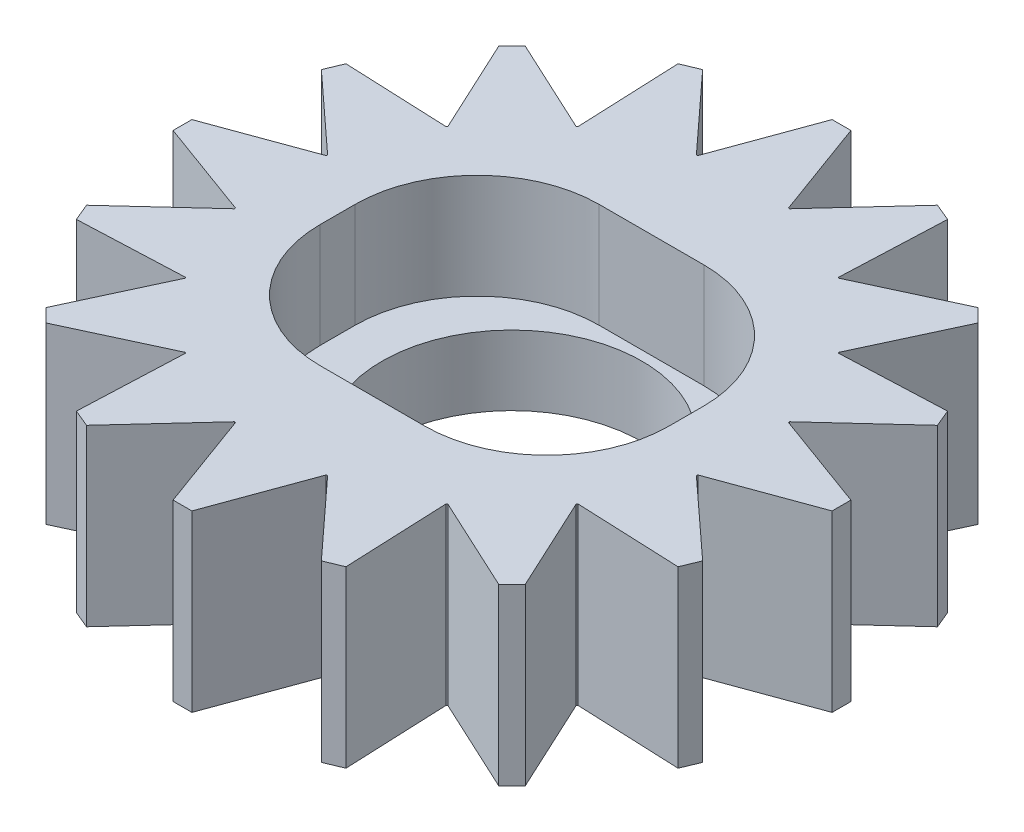
from build123d import *

# Parameters (mm, degrees)
SKETCH2_R           = 6.75
BOSS_EXTRUDE1_DEPTH = 5
SKETCH3_W           = 10
SKETCH3_H           = 8
CUT_EXTRUDE1_DEPTH  = 3
FILLET1_R           = 3.5
SKETCH4_R           = 3.725
CUT_EXTRUDE2_DEPTH  = 11.006248048
BOSS_EXTRUDE2_DEPTH = 5
CIRPATTERN1_COUNT   = 16


with BuildPart() as part:
    # Sketch2 → Boss-Extrude1 (new body)
    with BuildSketch(Plane(origin=(0, 0, 0), x_dir=(1, 0, 0), z_dir=(0, 1, 0))):
        with Locations(Location((0, 0, 0), (0, 0, 270))):
            Circle(SKETCH2_R)
    extrude(amount=BOSS_EXTRUDE1_DEPTH)

    # Sketch3 → Cut-Extrude1 (cut)
    with BuildSketch(Plane(origin=(0, 5, 0), x_dir=(1, 0, 0), z_dir=(0, 1, 0))):
        Rectangle(SKETCH3_W, SKETCH3_H)
    extrude(amount=-CUT_EXTRUDE1_DEPTH, mode=Mode.SUBTRACT)

    # Fillet1
    fillet1_edges = [part.edges().sort_by_distance(p)[0] for p in [
        (5, 3.5, -4),
        (5, 3.5, 4),
        (-5, 3.5, 4),
        (-5, 3.5, -4),
    ]]
    fillet(fillet1_edges, radius=FILLET1_R)

    # Sketch4 → Cut-Extrude2 (cut, through all)
    with BuildSketch(Plane(origin=(0, 2, 0), x_dir=(1, 0, 0), z_dir=(0, 1, 0))):
        with Locations(Location((0, 0, 0), (0, 0, 270))):
            Circle(SKETCH4_R)
    extrude(amount=-CUT_EXTRUDE2_DEPTH, mode=Mode.SUBTRACT)

    # Sketch5 → Boss-Extrude2 (add)
    with BuildSketch(Plane(origin=(0, 5, 0), x_dir=(1, 0, 0), z_dir=(0, 1, 0))):
        Polygon((-1.300127145, 6.623606979), (-0.269661895, 9.441952037), (0.269661895, 9.441952037), (1.300127145, 6.623606979), align=None)
        Polygon((-0.269661895, -9.441952037), (-1.300127145, -6.623606979), (1.300127145, -6.623606979), (0.269661895, -9.441952037), align=None)
    boss_extrude2 = extrude(amount=-BOSS_EXTRUDE2_DEPTH)

    # CirPattern1: Boss-Extrude2 ×16 about axis
    cirpattern1_axis = Axis((0, 0, 0), (0, 1, 0))
    for i in range(1, CIRPATTERN1_COUNT):
        add(boss_extrude2.rotate(cirpattern1_axis, i * 360 / CIRPATTERN1_COUNT))


solid = part.part
